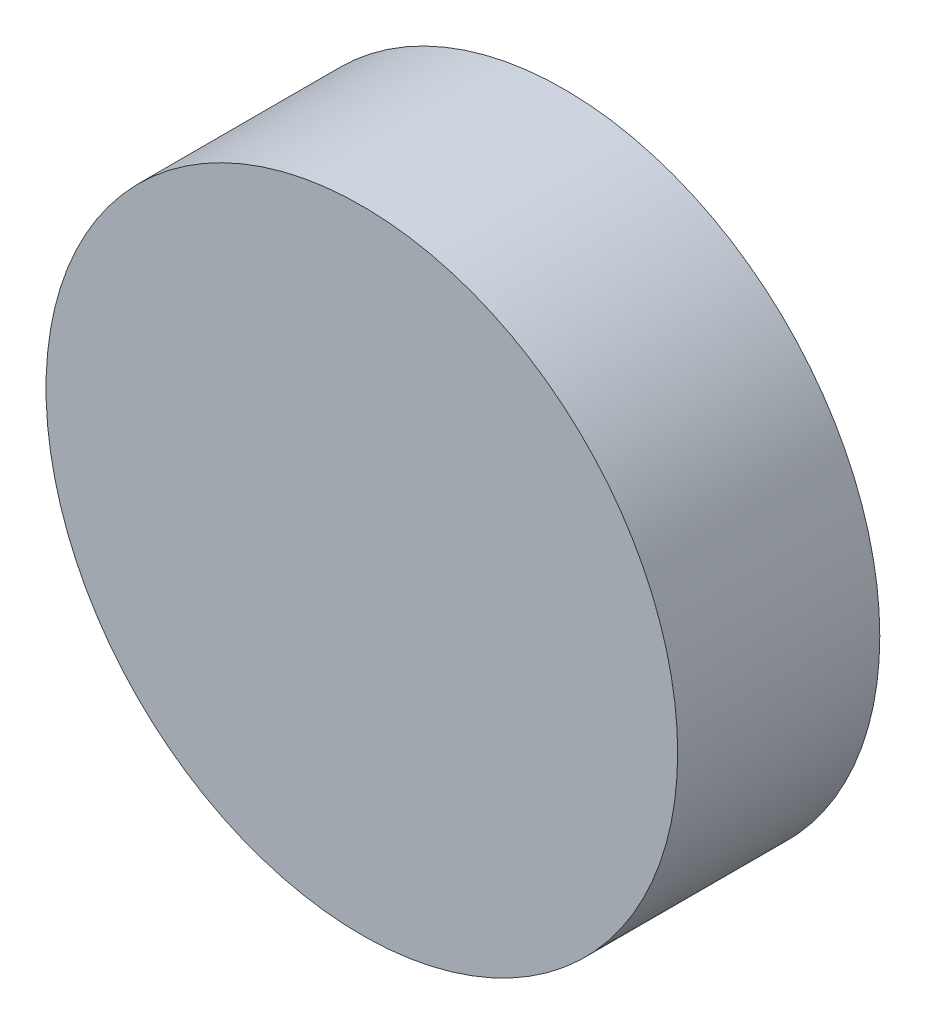
from build123d import *

# Parameters (mm, degrees)
ESQUISSE1_R        = 2.5
BOSS_EXTRU_1_DEPTH = 1.6


with BuildPart() as part:
    # Esquisse1 → Boss.-Extru.1 (new body)
    with BuildSketch(Plane.XY):
        Circle(ESQUISSE1_R)
    extrude(amount=BOSS_EXTRU_1_DEPTH)


solid = part.part
